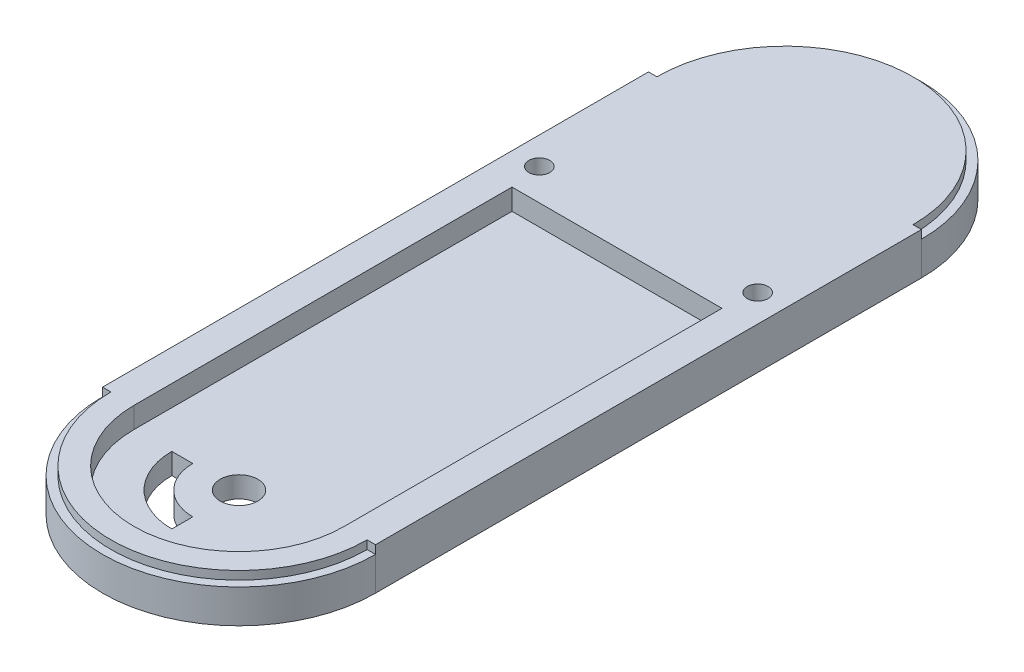
from build123d import *

# Parameters (mm, degrees)
BOSS_EXTRUDE1_DEPTH = 10
CUT_EXTRUDE4_DEPTH  = 5
SKETCH7_R           = 4.5
CUT_EXTRUDE5_DEPTH  = 5
CUT_EXTRUDE6_DEPTH  = 10
CUT_EXTRUDE7_START  = -2
CUT_EXTRUDE7_DEPTH  = 2
SKETCH11_R          = 2.5
CUT_EXTRUDE8_DEPTH  = 104.25938214


with BuildPart() as part:
    # Sketch1 → Boss-Extrude1 (new body)
    with BuildSketch(Plane(origin=(0, 0, 0), x_dir=(1, 0, 0), z_dir=(0, 1, 0))):
        with BuildLine():
            Line((-32.5, 65), (-32.5, -65))
            ThreePointArc((-32.5, -65), (0, -97.5), (32.5, -65))
            Line((32.5, -65), (32.5, 65))
            ThreePointArc((32.5, 65), (0, 97.5), (-32.5, 65))
        make_face()
    extrude(amount=BOSS_EXTRUDE1_DEPTH)

    # Sketch6 → Cut-Extrude4 (cut)
    with BuildSketch(Plane(origin=(0, 10, 0), x_dir=(1, 0, 0), z_dir=(0, 1, 0))):
        with BuildLine():
            Line((-25, -65), (-25, 25))
            Line((-25, 25), (25, 25))
            Line((25, 25), (25, -65))
            ThreePointArc((25, -65), (0, -90), (-25, -65))
        make_face()
    extrude(amount=-CUT_EXTRUDE4_DEPTH, mode=Mode.SUBTRACT)

    # Sketch7 → Cut-Extrude5 (cut)
    with BuildSketch(Plane(origin=(0, 5, 0), x_dir=(1, 0, 0), z_dir=(0, 1, 0))):
        with Locations(Location((0, -65, 0), (0, 0, 270))):
            Circle(SKETCH7_R)
    extrude(amount=-CUT_EXTRUDE5_DEPTH, mode=Mode.SUBTRACT)

    # Sketch8 → Cut-Extrude6 (cut)
    with BuildSketch(Plane(origin=(0, 5, 0), x_dir=(1, 0, 0), z_dir=(0, 1, 0))):
        with BuildLine():
            Line((-16, -65), (-11, -65))
            ThreePointArc((-11, -65), (-7.778174593, -72.778174593), (0, -76))
            Line((0, -76), (0, -81))
            ThreePointArc((0, -81), (-11.313708499, -76.313708499), (-16, -65))
        make_face()
    extrude(amount=-CUT_EXTRUDE6_DEPTH, mode=Mode.SUBTRACT)

    # Sketch9 → Cut-Extrude7 (cut)
    with BuildSketch(Plane(origin=(0, 10, 0), x_dir=(1, 0, 0), z_dir=(0, 1, 0)).offset(CUT_EXTRUDE7_START)):
        with BuildLine():
            Line((-32.5, -65), (-30.5, -65))
            ThreePointArc((-30.5, -65), (0, -95.5), (30.5, -65))
            Line((30.5, -65), (32.5, -65))
            ThreePointArc((32.5, -65), (0, -97.5), (-32.5, -65))
        make_face()
        with BuildLine():
            Line((-30.5, 65), (-32.5, 65))
            ThreePointArc((-32.5, 65), (0, 97.5), (32.5, 65))
            Line((32.5, 65), (30.5, 65))
            ThreePointArc((30.5, 65), (0, 95.5), (-30.5, 65))
        make_face()
    extrude(amount=CUT_EXTRUDE7_DEPTH, mode=Mode.SUBTRACT)

    # Sketch11 → Cut-Extrude8 (cut, through all)
    with BuildSketch(Plane(origin=(0, 10, 0), x_dir=(1, 0, 0), z_dir=(0, 1, 0))):
        with Locations(Location((26, 32.5, 0), (0, 0, 270))):
            Circle(SKETCH11_R)
        with Locations(Location((-26, 32.5, 0), (0, 0, 270))):
            Circle(SKETCH11_R)
    extrude(amount=-CUT_EXTRUDE8_DEPTH, mode=Mode.SUBTRACT)


solid = part.part
